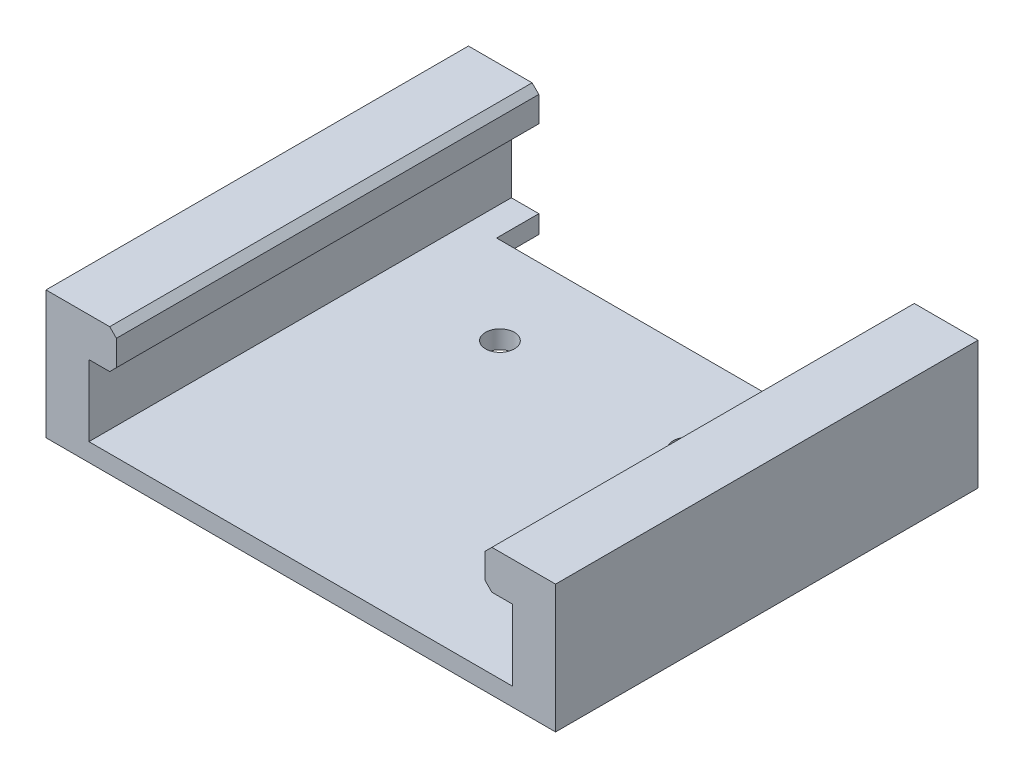
from build123d import *

# Parameters (mm, degrees)
EXTRUDE_1_DEPTH              = 31.5
HOLE_WIZARD_M3_1_D           = 2.5
HOLE_WIZARD_M3_1_DEPTH       = 14
HOLE_WIZARD_M3_1_CBORE_D     = 3
HOLE_WIZARD_M3_1_CBORE_DEPTH = 13.5
HOLE_WIZARD_M3_1_TIP         = 0.751075774
HOLE_WIZARD_M4_1_D           = 4.3
CUT_EXTRUDE_1_REACH          = 54.012
SKETCH_6_W                   = 55
SKETCH_6_H                   = 6.3
CHAMFER_1_SIZE               = 1


with BuildPart() as part:
    # 草图1 → 凸台-拉伸1 (new, symmetric)
    with BuildSketch(Plane.XY):
        Polygon((-27.5, 19.1), (-38, 19.1), (-38, 0), (38, 0), (38, 19.1), (27.5, 19.1), (27.5, 13.3), (31.6, 13.3), (31.6, 2.7), (-31.6, 2.7), (-31.6, 13.3), (-27.5, 13.3), align=None)
    extrude(amount=EXTRUDE_1_DEPTH, both=True)

    # M3 螺纹孔1
    with Locations(Plane(origin=(0, 0, 0), x_dir=(-1, 0, 0), z_dir=(0, -1, 0))):
        with Locations((34.8, 25.5), (34.8, -25.5), (-34.8, -25.5), (-34.8, 25.5)):
            CounterBoreHole(HOLE_WIZARD_M3_1_D / 2, HOLE_WIZARD_M3_1_CBORE_D / 2, HOLE_WIZARD_M3_1_CBORE_DEPTH, depth=HOLE_WIZARD_M3_1_DEPTH)
            with Locations((0, 0, -(HOLE_WIZARD_M3_1_DEPTH + HOLE_WIZARD_M3_1_TIP / 2))):  # 118° drill point
                Cone(0, HOLE_WIZARD_M3_1_D / 2, HOLE_WIZARD_M3_1_TIP, mode=Mode.SUBTRACT)

    # M4 间隙孔1 (through all)
    with Locations(Plane(origin=(0, 0, 0), x_dir=(-1, 0, 0), z_dir=(0, -1, 0))):
        with Locations((-14, 12.2), (14, 12.2)):
            Hole(HOLE_WIZARD_M4_1_D / 2)

    # 草图6 → 切除-拉伸1 (cut, up to next)
    with BuildSketch(Plane(origin=(0, 2.7, 0), x_dir=(1, 0, 0), z_dir=(0, 1, 0)), mode=Mode.PRIVATE) as cut_extrude_1_sk1:
        with Locations((0, 28.35)):
            Rectangle(SKETCH_6_W, SKETCH_6_H)
    cut_extrude_1_tool1 = extrude(cut_extrude_1_sk1.sketch, amount=-CUT_EXTRUDE_1_REACH, mode=Mode.PRIVATE) & part.part
    add(cut_extrude_1_tool1.solids().sort_by_distance((0, 2.7, -28.35))[0], mode=Mode.SUBTRACT)

    # 倒角1
    chamfer_1_edges = [part.edges().sort_by_distance(p)[0] for p in [
        (-27.5, 13.3, 0),
        (27.5, 13.3, 0),
        (27.5, 19.1, 0),
        (-27.5, 19.1, 0),
    ]]
    chamfer(chamfer_1_edges, length=CHAMFER_1_SIZE)


solid = part.part
